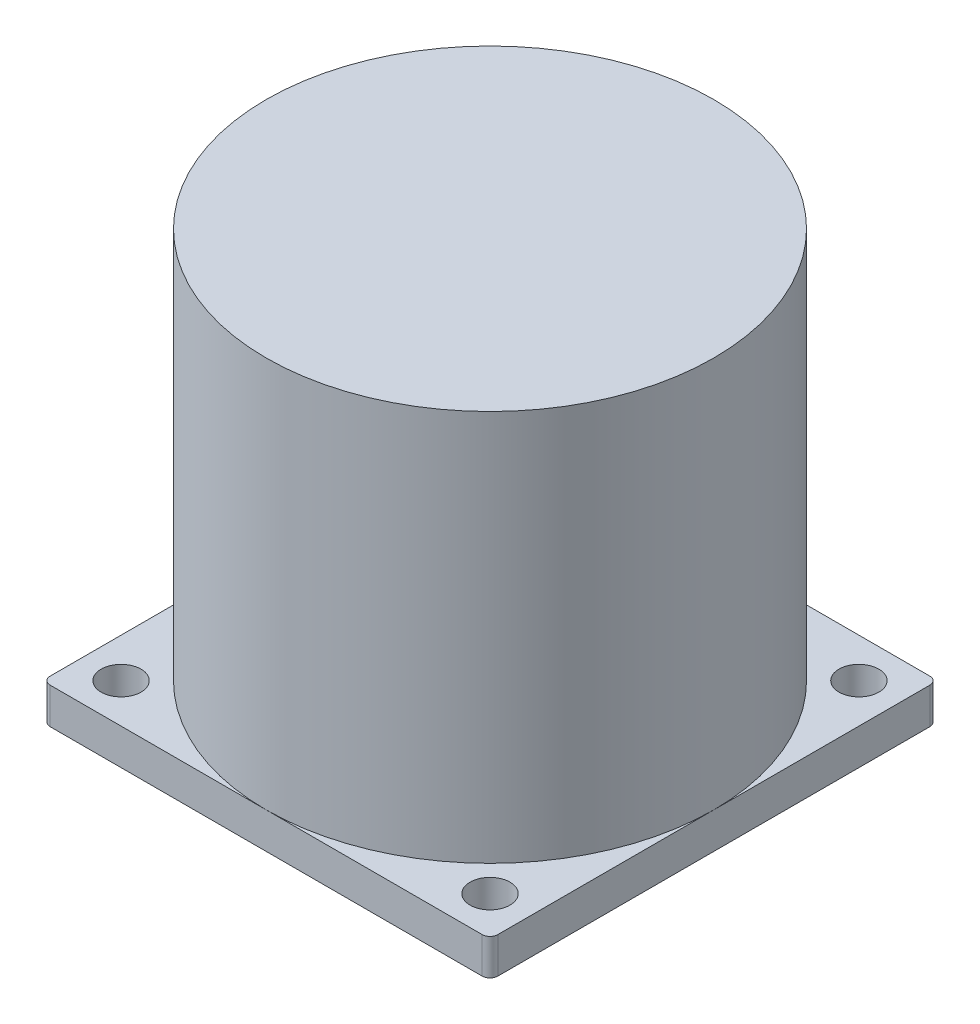
from build123d import *

# Parameters (mm, degrees)
SKETCH_1_W                  = 57.2
SKETCH_1_H                  = 57.2
EXTRUDE_1_DEPTH             = 4.6
SKETCH_2_W                  = 28.6
SKETCH_2_H                  = 50
HOLE_WIZARD_5_1_5_1_1_D     = 5.1
HOLE_WIZARD_5_1_5_1_1_DEPTH = 54.6
FILLET_1_R                  = 1


with BuildPart() as part:
    # Эскиз1 → Бобышка-Вытянуть1 (new body)
    with BuildSketch(Plane.XZ.offset(4.6)):
        Rectangle(SKETCH_1_W, SKETCH_1_H)
    extrude(amount=-EXTRUDE_1_DEPTH)

    # Эскиз2 → Повернуть1 (revolve)
    with BuildSketch(Plane.XY, mode=Mode.PRIVATE) as revolve_1_sk:
        with Locations((14.3, 25)):
            Rectangle(SKETCH_2_W, SKETCH_2_H)
    revolve(revolve_1_sk.sketch.rotate(Axis((0, 50, 0), (0, -1, 0)), 270), axis=Axis((0, 50, 0), (0, -1, 0)))

    # Эскиз3 → Повернуть2 (revolve)
    with BuildSketch(Plane(origin=(0, 0, 0), x_dir=(-1, 0, 0), z_dir=(0, 0, -1)), mode=Mode.PRIVATE) as revolve_2_sk:
        Polygon((-3.175, -25.2), (0, -25.2), (0, -4.6), (-19.05, -4.6), (-19.05, -6.2), (-3.175, -6.2), align=None)
    revolve(revolve_2_sk.sketch.rotate(Axis((0, -25.2, 0), (0, 1, 0)), 270), axis=Axis((0, -25.2, 0), (0, 1, 0)))

    # Диаметр отверстия Ø5.1 (5.1)1
    with Locations(Plane(origin=(0, -4.6, 0), x_dir=(-1, 0, 0), z_dir=(0, -1, 0))):
        with Locations((23.57, 23.57), (23.57, -23.57), (-23.57, -23.57), (-23.57, 23.57)):
            Hole(HOLE_WIZARD_5_1_5_1_1_D / 2, depth=HOLE_WIZARD_5_1_5_1_1_DEPTH)

    # Скругление1
    fillet_1_edges = [part.edges().sort_by_distance(p)[0] for p in [
        (28.6, -2.3, 28.6),
        (28.6, -2.3, -28.6),
        (-28.6, -2.3, -28.6),
        (-28.6, -2.3, 28.6),
    ]]
    fillet(fillet_1_edges, radius=FILLET_1_R)


solid = part.part
